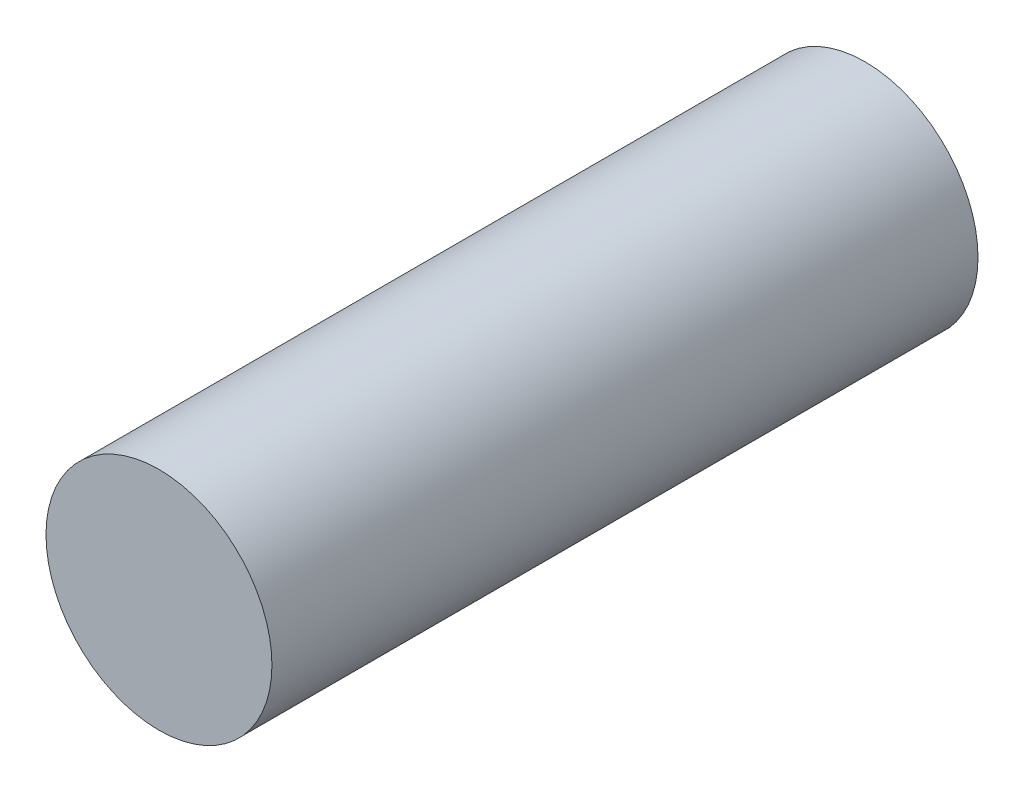
from build123d import *

# Parameters (mm, degrees)
SKETCH_1_R      = 4
EXTRUDE_1_DEPTH = 12.5


with BuildPart() as part:
    # 草图1 → 凸台-拉伸1 (new, symmetric)
    with BuildSketch(Plane.XY):
        with Locations((0, -175)):
            Circle(SKETCH_1_R)
    extrude(amount=EXTRUDE_1_DEPTH, both=True)


solid = part.part
